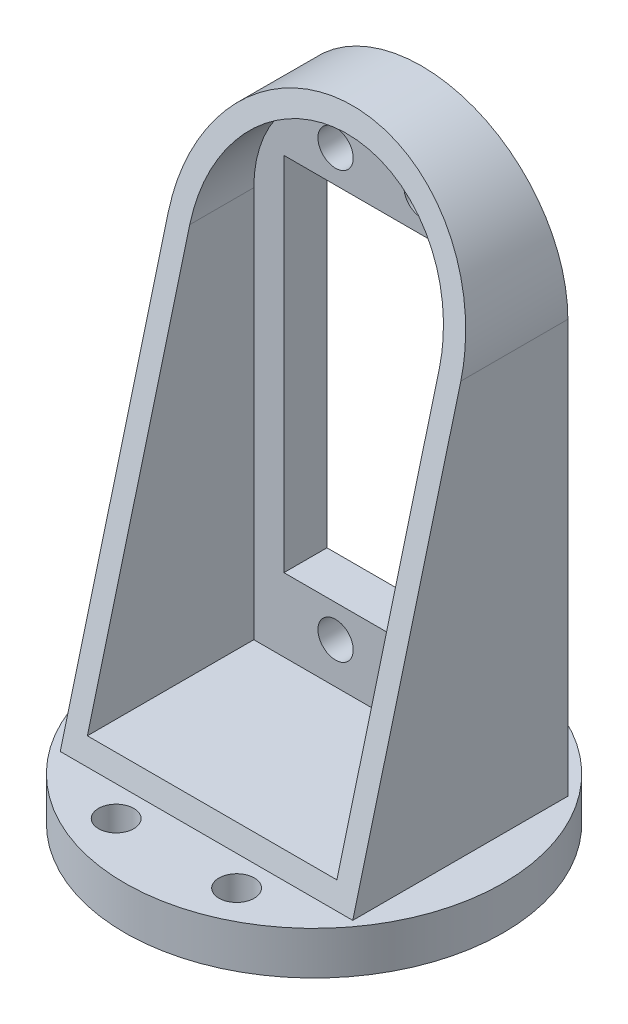
from build123d import *

# Parameters (mm, degrees)
SKETCH1_W           = 22
SKETCH1_H           = 42
SKETCH1_R           = 2.05
BOSS_EXTRUDE1_DEPTH = 5
BOSS_EXTRUDE2_DEPTH = 20
CUT_EXTRUDE1_DEPTH  = 54.572380944
SKETCH4_R           = 22
BOSS_EXTRUDE3_DEPTH = 5
SKETCH5_R           = 2.05
CUT_EXTRUDE2_DEPTH  = 5


with BuildPart() as part:
    # Sketch1 → Boss-Extrude1 (new body)
    with BuildSketch(Plane.XY):
        with BuildLine():
            Line((17, -32), (17, 16))
            ThreePointArc((17, 16), (0, 33), (-17, 16))
            Line((-17, 16), (-17, -32))
            Line((-17, -32), (17, -32))
        make_face()
        Rectangle(SKETCH1_W, SKETCH1_H, mode=Mode.SUBTRACT)
        with Locations((5, -24.75)):
            Circle(SKETCH1_R, mode=Mode.SUBTRACT)
        with Locations((-5, -24.75)):
            Circle(SKETCH1_R, mode=Mode.SUBTRACT)
        with Locations((5, 24.75)):
            Circle(SKETCH1_R, mode=Mode.SUBTRACT)
        with Locations((-5, 24.75)):
            Circle(SKETCH1_R, mode=Mode.SUBTRACT)
    extrude(amount=BOSS_EXTRUDE1_DEPTH)

    # Sketch2 → Boss-Extrude2 (add)
    with BuildSketch(Plane.XY.offset(5)):
        with BuildLine():
            Line((17, -32), (17, 16))
            ThreePointArc((17, 16), (0, 33), (-17, 16))
            Line((-17, 16), (-17, -32))
            Line((-17, -32), (17, -32))
        make_face()
        with BuildLine():
            Line((-14.5, 16), (-14.5, -29.5))
            Line((-14.5, -29.5), (14.5, -29.5))
            Line((14.5, -29.5), (14.5, 16))
            ThreePointArc((14.5, 16), (0, 30.5), (-14.5, 16))
        make_face(mode=Mode.SUBTRACT)
    extrude(amount=BOSS_EXTRUDE2_DEPTH)

    # Sketch3 → Cut-Extrude1 (cut, through all)
    with BuildSketch(Plane(origin=(17, 0, 0), x_dir=(0, 0, -1), z_dir=(1, 0, 0))):
        Polygon((-25, -32), (-8, 33), (-25, 33), align=None)
    extrude(amount=-CUT_EXTRUDE1_DEPTH, mode=Mode.SUBTRACT)

    # Sketch4 → Boss-Extrude3 (add)
    with BuildSketch(Plane.XZ.offset(32)):
        with Locations((0, 12.5)):
            Circle(SKETCH4_R)
    extrude(amount=BOSS_EXTRUDE3_DEPTH)

    # Sketch5 → Cut-Extrude2 (cut)
    with BuildSketch(Plane(origin=(0, -32, 0), x_dir=(1, 0, 0), z_dir=(0, 1, 0))):
        with Locations(Location((0, 5, 0), (0, 0, 180))):
            Circle(SKETCH5_R)
        with Locations(Location((-7, -28.5, 0), (0, 0, 180))):
            Circle(SKETCH5_R)
        with Locations(Location((7, -28.5, 0), (0, 0, 180))):
            Circle(SKETCH5_R)
    extrude(amount=-CUT_EXTRUDE2_DEPTH, mode=Mode.SUBTRACT)


solid = part.part
